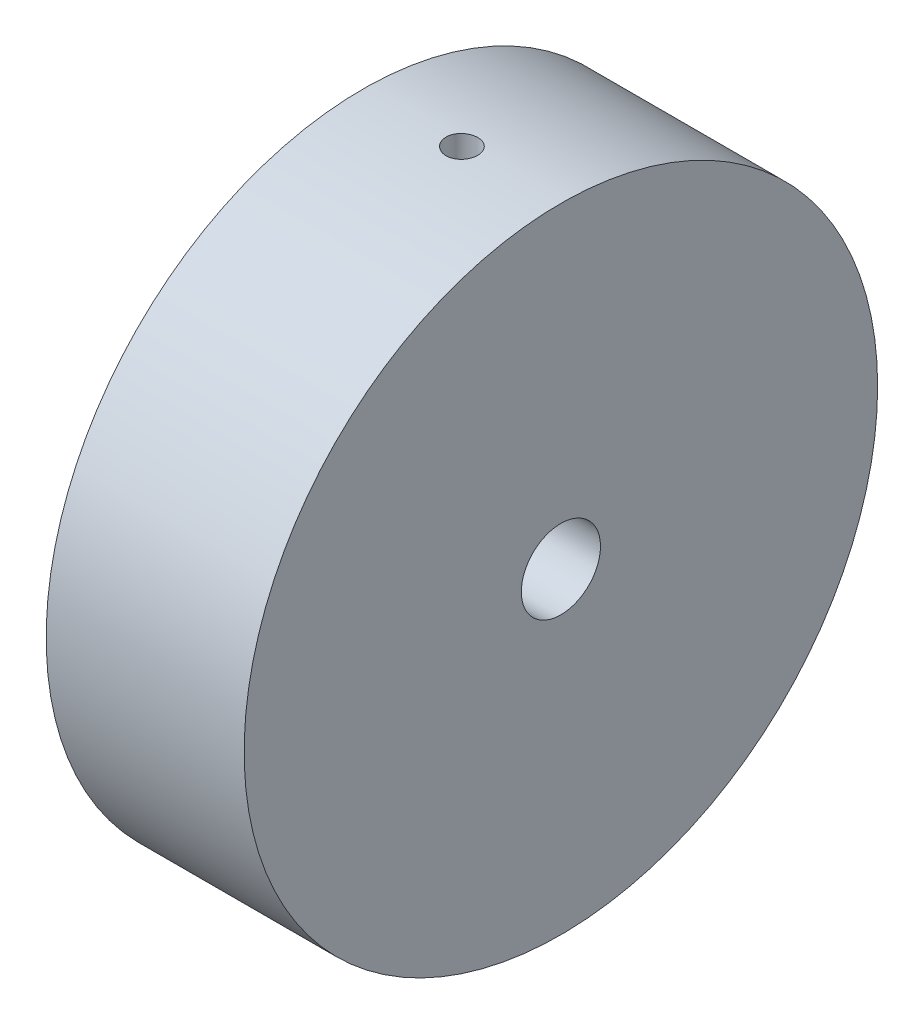
from build123d import *

# Parameters (mm, degrees)
ESBO_O6_R             = 0.8
CORTE_EXTRUS_O1_DEPTH = 35


with BuildPart() as part:
    # Esboço3 → Revolução1 (revolve)
    with BuildSketch(Plane.XY, mode=Mode.PRIVATE) as revolu_o1_sk:
        Polygon((0, 16), (0, 2), (-8, 2), (-8, 0), (-10, 0), (-10, 5), (-2, 5), (-2, 14), (-10, 14), (-10, 16), align=None)
    revolve(revolu_o1_sk.sketch.rotate(Axis((0, 0, 0), (-1, 0, 0)), 90), axis=Axis((0, 0, 0), (-1, 0, 0)))

    # Esboço6 → Corte-extrusão1 (cut, symmetric)
    with BuildSketch(Plane(origin=(0, 5, 0), x_dir=(1, 0, 0), z_dir=(0, 1, 0))):
        with Locations(Location((-5, 0, 0), (0, 0, 270))):
            Circle(ESBO_O6_R)
    extrude(amount=CORTE_EXTRUS_O1_DEPTH, both=True, mode=Mode.SUBTRACT)


solid = part.part
